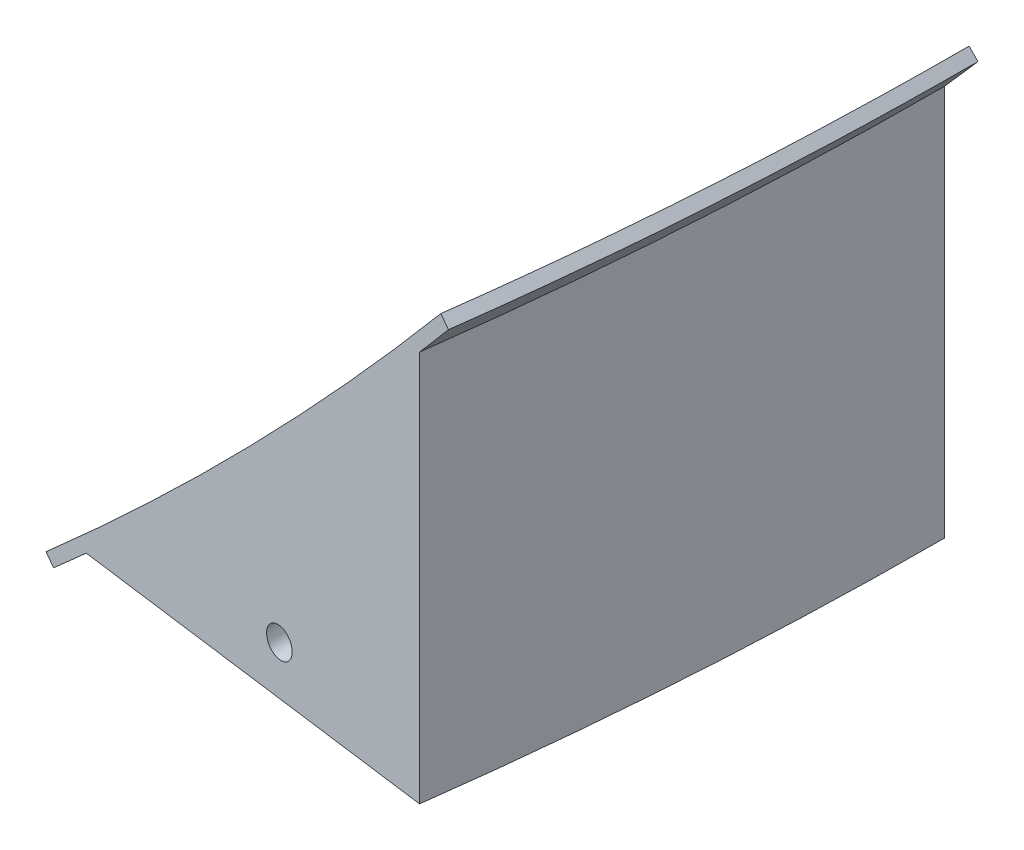
from build123d import *

# Parameters (mm, degrees)
REVOLVE2_ANGLE           = 7.5
SKETCH4_W                = 33.25
SKETCH4_H                = 13
CUT_EXTRUDE5_DEPTH       = 19
SKETCH7_W                = 33.25
SKETCH7_H                = 13
CUT_EXTRUDE7_DEPTH       = 19
CUT_EXTRUDE11_DEPTH      = 1411.389609827
CUT_EXTRUDE11_DEPTH_BACK = 1411.389609827
SKETCH10_W               = 2135.270707333
SKETCH10_H               = 1606.592084843
SKETCH10_W_2             = 966.47859296
SKETCH10_H_2             = 313.33759653
CUT_EXTRUDE12_DEPTH      = 268.568661532
CUT_EXTRUDE12_DEPTH_BACK = 268.568661532
CUT_EXTRUDE13_DEPTH      = 1057.643677587
CUT_EXTRUDE13_DEPTH_BACK = 1057.643677587
SKETCH14_R               = 2.904277488


with BuildPart() as part:
    # Sketch2 → Revolve2 (revolve)
    with BuildSketch(Plane.XY):
        with BuildLine():
            Line((0, 993.075249624), (0, 990.6))
            ThreePointArc((0, 990.6), (990.6, 0), (0, -990.6))
            Line((0, -990.6), (0, -993.075249624))
            ThreePointArc((0, -993.075249624), (357.30221933, -926.570869107), (666.748724276, -735.965073963))
            Line((666.748724276, -735.965073963), (742.973100692, -735.965073963))
            Line((742.973100692, -735.965073963), (742.973100692, -658.930514596))
            ThreePointArc((742.973100692, -658.930514596), (993.075236283, 0.162783709), (742.757038562, 659.174053709))
            Line((742.757038562, 659.174053709), (742.757038562, 722.715073963))
            Line((742.757038562, 722.715073963), (681.088374063, 722.715073963))
            ThreePointArc((681.088374063, 722.715073963), (366.393230651, 923.013787519), (0, 993.075249624))
        make_face()
    revolve(axis=Axis((0, 993.075249624, 0), (0, -1, 0)), revolution_arc=REVOLVE2_ANGLE)

    # Sketch4 → Cut-Extrude5 (cut)
    with BuildSketch(Plane.XZ.offset(735.965073963)):
        with Locations((705.258501449, 49.061390401)):
            Rectangle(SKETCH4_W, SKETCH4_H)
    extrude(amount=-CUT_EXTRUDE5_DEPTH, mode=Mode.SUBTRACT)

    # Sketch7 → Cut-Extrude7 (cut)
    with BuildSketch(Plane(origin=(0, 722.715073963, 0), x_dir=(-1, 0, 0), z_dir=(0, 1, 0))):
        with Locations((-714.999743141, 46.422731407)):
            Rectangle(SKETCH7_W, SKETCH7_H)
    extrude(amount=-CUT_EXTRUDE7_DEPTH, mode=Mode.SUBTRACT)

    # Sketch10 → Cut-Extrude11 (cut, two sides: drawn at the far end of the back side and taken through both)
    with BuildSketch(Plane.XY.offset(-CUT_EXTRUDE11_DEPTH_BACK)):
        with Locations((557.489585025, 267.498147025)):
            Rectangle(SKETCH10_W, SKETCH10_H)
        with Locations((142.971717026, -995.026755504)):
            Rectangle(SKETCH10_W_2, SKETCH10_H_2)
    extrude(amount=CUT_EXTRUDE11_DEPTH + CUT_EXTRUDE11_DEPTH_BACK, mode=Mode.SUBTRACT)

    # Sketch13 → Cut-Extrude12 (cut, two sides: drawn at the far end of the back side and taken through both)
    with BuildSketch(Plane(origin=(698.790958408, -705.612958968, 0), x_dir=(-0.7105332241790022, -0.7036636535574307, 0), z_dir=(0.7036636535574307, -0.7105332241790022, 0)).offset(-CUT_EXTRUDE12_DEPTH_BACK)):
        with BuildLine():
            Line((-69.681834332, -97.908818451), (-74.241619372, -183.690208107))
            Line((-74.241619372, -183.690208107), (-254.584821077, -153.98925059))
            Line((-254.584821077, -153.98925059), (-254.584821077, 36.219080684))
            Line((-254.584821077, 36.219080684), (-86.443079936, 59.043829873))
            Line((-86.443079936, 59.043829873), (-74.241619372, 0))
            add(Edge.make_bspline(
                [(-74.241619372, 0), (-74.241619372, -16.364172879), (-73.860987213, -32.728340935), (-72.340019213, -65.387598256), (-71.199683881, -81.682677909), (-69.681834332, -97.908818451)],
                knots=[0, 0, 0, 0, 0.5, 0.5, 1, 1, 1, 1], degree=3))
        make_face()
        with BuildLine():
            Line((58.134257499, -86.096803452), (71.382276514, -183.690208107))
            Line((71.382276514, -183.690208107), (231.781280969, -140.799513279))
            Line((231.781280969, -140.799513279), (262.814223376, 47.631455278))
            Line((262.814223376, 47.631455278), (38.648828203, 72.943770658))
            Line((38.648828203, 72.943770658), (54.124752058, 0))
            add(Edge.make_bspline(
                [(54.124752058, 0), (54.124752058, -14.39118635), (54.459503156, -28.782368118), (55.797005676, -57.502130085), (56.799756733, -71.830701127), (58.134257499, -86.096803452)],
                knots=[0, 0, 0, 0, 0.5, 0.5, 1, 1, 1, 1], degree=3))
        make_face()
    extrude(amount=CUT_EXTRUDE12_DEPTH + CUT_EXTRUDE12_DEPTH_BACK, mode=Mode.SUBTRACT)

    # Sketch14 → Cut-Extrude13 (cut, two sides: drawn at the far end of the back side and taken through both)
    with BuildSketch(Plane(origin=(0, 0, 55.561390401), x_dir=(-1, 0, 0), z_dir=(0, 0, -1)).offset(-CUT_EXTRUDE13_DEPTH_BACK)):
        with Locations((-704.851033101, -726.404105815)):
            Circle(SKETCH14_R)
    extrude(amount=CUT_EXTRUDE13_DEPTH + CUT_EXTRUDE13_DEPTH_BACK, mode=Mode.SUBTRACT)


solid = part.part
